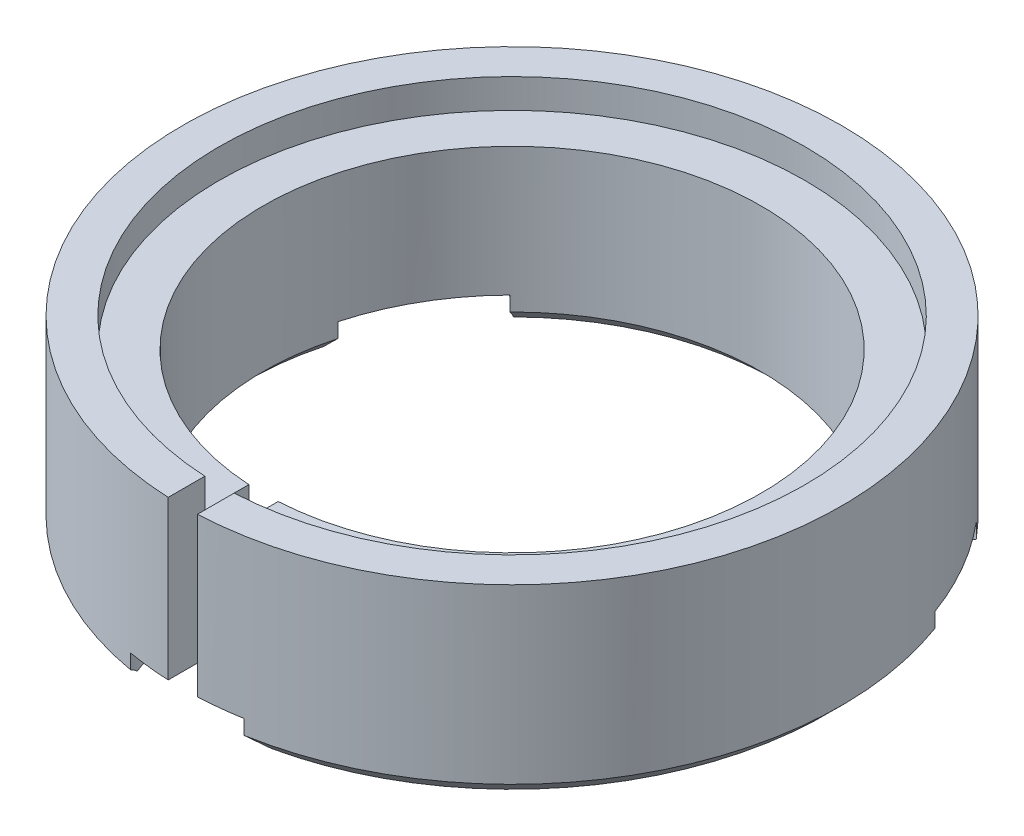
from build123d import *

# Parameters (mm, degrees)
SKETCH1_R           = 11.25
SKETCH1_R_2         = 8.5
BOSS_EXTRUDE1_DEPTH = 6.4
SKETCH2_R           = 10
CUT_EXTRUDE1_DEPTH  = 1
CHAMFER1_SIZE       = 0.5
SKETCH3_R           = 2.5
CUT_EXTRUDE2_DEPTH  = 1
SKETCH4_W           = 1
SKETCH4_H           = 7.023795273
CUT_EXTRUDE3_DEPTH  = 10


with BuildPart() as part:
    # Sketch1 → Boss-Extrude1 (new body)
    with BuildSketch(Plane(origin=(0, 0, 0), x_dir=(1, 0, 0), z_dir=(0, 1, 0))):
        Circle(SKETCH1_R)
        Circle(SKETCH1_R_2, mode=Mode.SUBTRACT)
    extrude(amount=BOSS_EXTRUDE1_DEPTH)

    # Sketch2 → Cut-Extrude1 (cut)
    with BuildSketch(Plane(origin=(0, 6.4, 0), x_dir=(1, 0, 0), z_dir=(0, 1, 0))):
        Circle(SKETCH2_R)
    extrude(amount=-CUT_EXTRUDE1_DEPTH, mode=Mode.SUBTRACT)

    # Chamfer1
    chamfer1_edges = [part.edges().sort_by_distance(p)[0] for p in [
        (-8.5, 0, 0),
        (-11.25, 0, 0),
    ]]
    chamfer(chamfer1_edges, length=CHAMFER1_SIZE)

    # Sketch3 → Cut-Extrude2 (cut)
    with BuildSketch(Plane.XZ):
        with Locations((0, 9.5)):
            Circle(SKETCH3_R)
        with Locations((8.227241336, -4.75)):
            Circle(SKETCH3_R)
        with Locations((-8.227241336, -4.75)):
            Circle(SKETCH3_R)
    extrude(amount=-CUT_EXTRUDE2_DEPTH, mode=Mode.SUBTRACT)

    # Sketch4 → Cut-Extrude3 (cut)
    with BuildSketch(Plane.XZ):
        with Locations((0, 9.698212769)):
            Rectangle(SKETCH4_W, SKETCH4_H)
    extrude(amount=-CUT_EXTRUDE3_DEPTH, mode=Mode.SUBTRACT)


solid = part.part
